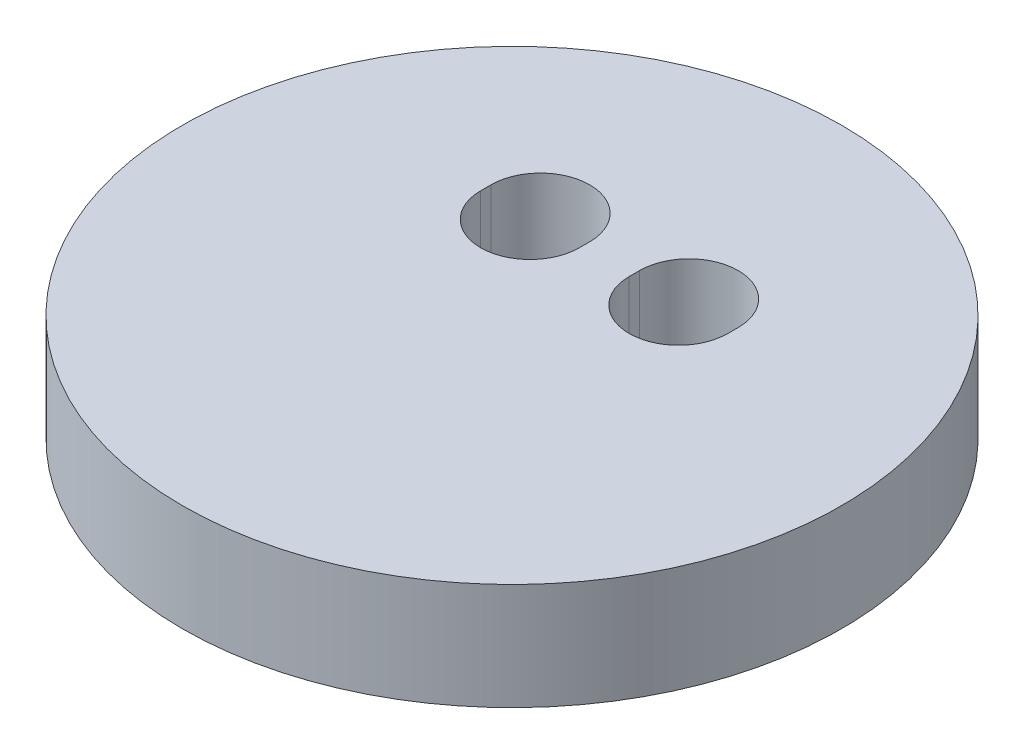
from build123d import *

# Parameters (mm, degrees)
SKETCH1_R           = 12.36
BOSS_EXTRUDE1_DEPTH = 4
CUT_EXTRUDE1_DEPTH  = 18.931514158


with BuildPart() as part:
    # Sketch1 → Boss-Extrude1 (new body)
    with BuildSketch(Plane(origin=(0, 0, 0), x_dir=(1, 0, 0), z_dir=(0, 1, 0))):
        with Locations(Location((0, 0, 0), (0, 0, 270))):
            Circle(SKETCH1_R)
    extrude(amount=BOSS_EXTRUDE1_DEPTH)

    # Sketch2 → Cut-Extrude1 (cut, through all)
    with BuildSketch(Plane(origin=(0, 4, 0), x_dir=(1, 0, 0), z_dir=(0, 1, 0))):
        with BuildLine():
            Line((4.635, 3.85), (4.635, 3.46))
            ThreePointArc((4.635, 3.46), (2.785, 1.61), (0.935, 3.46))
            Line((0.935, 3.46), (0.935, 3.85))
            ThreePointArc((0.935, 3.85), (2.785, 5.7), (4.635, 3.85))
        make_face()
        with BuildLine():
            Line((-0.935, 3.85), (-0.935, 3.46))
            ThreePointArc((-0.935, 3.46), (-2.785, 1.61), (-4.635, 3.46))
            Line((-4.635, 3.46), (-4.635, 3.85))
            ThreePointArc((-4.635, 3.85), (-2.785, 5.7), (-0.935, 3.85))
        make_face()
    extrude(amount=-CUT_EXTRUDE1_DEPTH, mode=Mode.SUBTRACT)


solid = part.part
